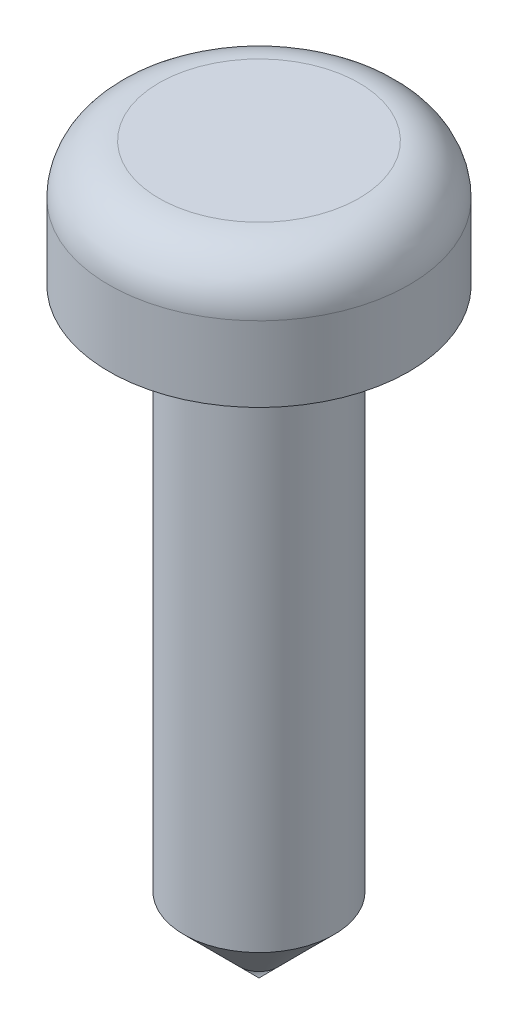
from build123d import *

# Parameters (mm, degrees)
FILLET_1_R = 1


with BuildPart() as part:
    # Эскиз1 → Шуруп М3х6 (revolve)
    with BuildSketch(Plane.XY, mode=Mode.PRIVATE) as revolve_3_6_sk:
        Polygon((0, 14.5), (3, 14.5), (3, 12), (1.5, 12), (1.5, 1.5), (0, 0), align=None)
    revolve(revolve_3_6_sk.sketch.rotate(Axis((0, 14.5, 0), (0, -1, 0)), 180), axis=Axis((0, 14.5, 0), (0, -1, 0)))

    # Скругление1
    fillet_1_edges = [part.edges().sort_by_distance(p)[0] for p in [
        (3, 14.5, 0),
    ]]
    fillet(fillet_1_edges, radius=FILLET_1_R)


solid = part.part
